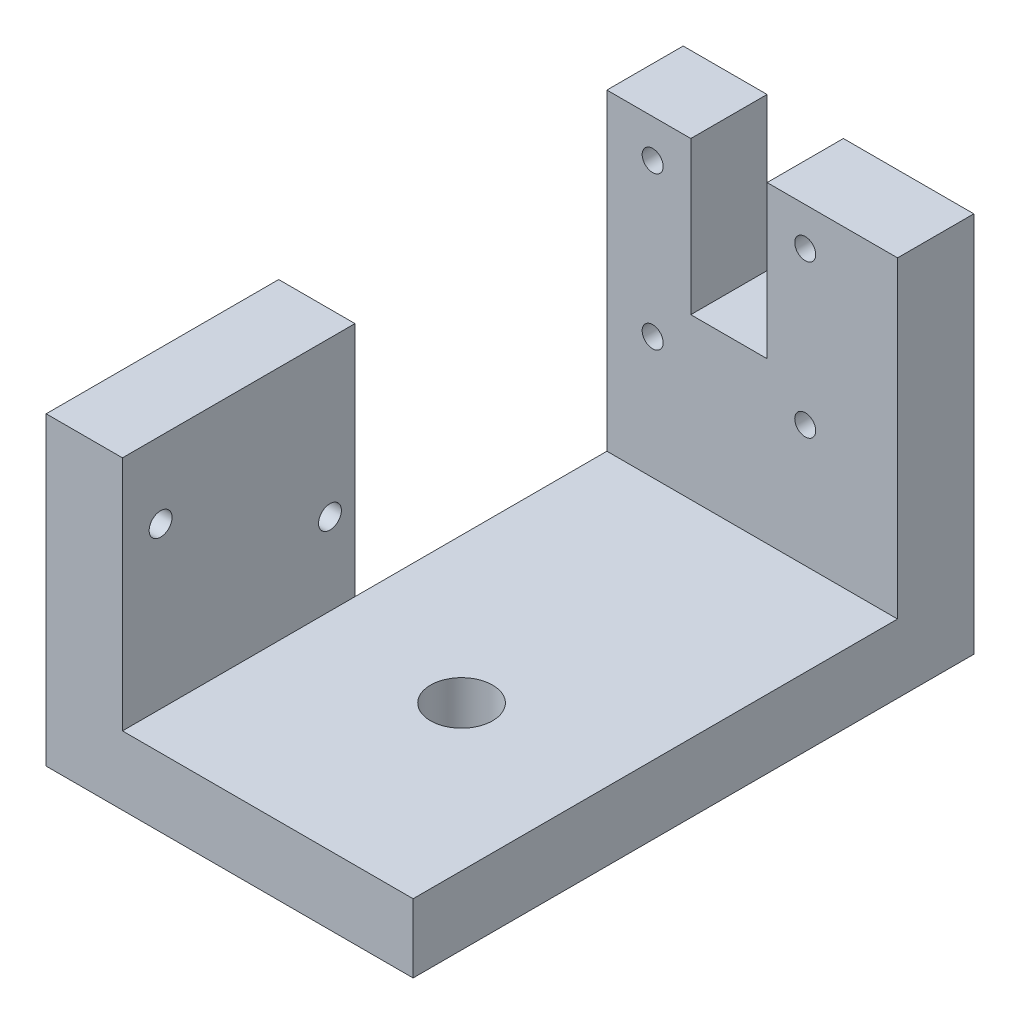
from build123d import *

# Parameters (mm, degrees)
SKETCH1_W           = 38.1
SKETCH1_H           = 63.5
BOSS_EXTRUDE1_DEPTH = 9
SKETCH1_3_W         = 10
SKETCH1_3_H         = 30.48
BOSS_EXTRUDE2_DEPTH = 40
SKETCH2_R           = 1.5
CUT_EXTRUDE1_DEPTH  = 10
SKETCH3_R           = 1.375
BOSS_EXTRUDE3_DEPTH = 10
CUT_EXTRUDE2_DEPTH  = 9


with BuildPart() as part:
    # Sketch1 → Boss-Extrude1 (new body)
    with BuildSketch(Plane(origin=(0, 0, 0), x_dir=(1, 0, 0), z_dir=(0, 1, 0))):
        Rectangle(SKETCH1_W, SKETCH1_H)
    extrude(amount=BOSS_EXTRUDE1_DEPTH)

    # Sketch1<3> → Boss-Extrude2 (add)
    with BuildSketch(Plane(origin=(0, 0, 0), x_dir=(1, 0, 0), z_dir=(0, 1, 0))):
        with Locations((-24.05, -16.51)):
            Rectangle(SKETCH1_3_W, SKETCH1_3_H)
    extrude(amount=BOSS_EXTRUDE2_DEPTH)

    # Sketch2 → Cut-Extrude1 (cut)
    with BuildSketch(Plane.ZY.offset(29.05)):
        with Locations((4.55, 19.7)):
            Circle(SKETCH2_R)
        with Locations((26.75, 30)):
            Circle(SKETCH2_R)
    extrude(amount=-CUT_EXTRUDE1_DEPTH, mode=Mode.SUBTRACT)

    # Sketch3 → Boss-Extrude3 (add)
    with BuildSketch(Plane(origin=(0, 0, -31.75), x_dir=(-1, 0, 0), z_dir=(0, 0, -1))):
        Polygon((-19.05, 0), (19.05, 0), (19.05, 50), (8.05, 50), (8.05, 30), (-1.95, 30), (-1.95, 50), (-19.05, 50), align=None)
        with Locations((-6.95, 25)):
            Circle(SKETCH3_R, mode=Mode.SUBTRACT)
        with Locations((-6.95, 45)):
            Circle(SKETCH3_R, mode=Mode.SUBTRACT)
        with Locations((13.05, 25)):
            Circle(SKETCH3_R, mode=Mode.SUBTRACT)
        with Locations((13.05, 45)):
            Circle(SKETCH3_R, mode=Mode.SUBTRACT)
    extrude(amount=BOSS_EXTRUDE3_DEPTH)

    # Sketch1<4> → Cut-Extrude2 (cut)
    with BuildSketch(Plane(origin=(0, 0, 0), x_dir=(1, 0, 0), z_dir=(0, 1, 0))):
        with BuildLine():
            ThreePointArc((4.064, -6.35), (2.873681959, -3.476318041), (0, -2.286))
            Line((0, -2.286), (0, -10.414))
            ThreePointArc((0, -10.414), (2.873681959, -9.223681959), (4.064, -6.35))
        make_face()
        with BuildLine():
            Line((0, -10.414), (0, -2.286))
            ThreePointArc((0, -2.286), (-4.064, -6.35), (0, -10.414))
        make_face()
    extrude(amount=CUT_EXTRUDE2_DEPTH, mode=Mode.SUBTRACT)


solid = part.part
